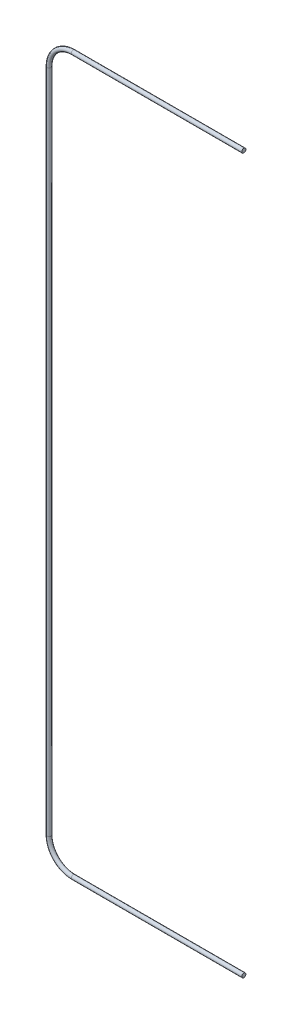
from build123d import *

# Parameters (mm, degrees)
SWEEP1_PROFILE_R = 6.35


with BuildPart() as part:
    # Sweep1: sweep along a path in Sketch1
    with BuildLine(Plane.XY) as sweep1_path:
        Line((600, 1100), (75, 1100))
        ThreePointArc((75, 1100), (21.966991411, 1078.033008589), (0, 1025))
        Line((0, 1025), (0, -1025))
        ThreePointArc((0, -1025), (21.966991411, -1078.033008589), (75, -1100))
        Line((75, -1100), (600, -1100))
    # Sweep1 profile (on start of the path) → Sweep1 (sweep)
    with BuildSketch(Plane(origin=(600, 1100, 0), x_dir=(0, 0, -1), z_dir=(-1, 0, 0))):
        Circle(SWEEP1_PROFILE_R)
    sweep(path=sweep1_path.line)


solid = part.part
